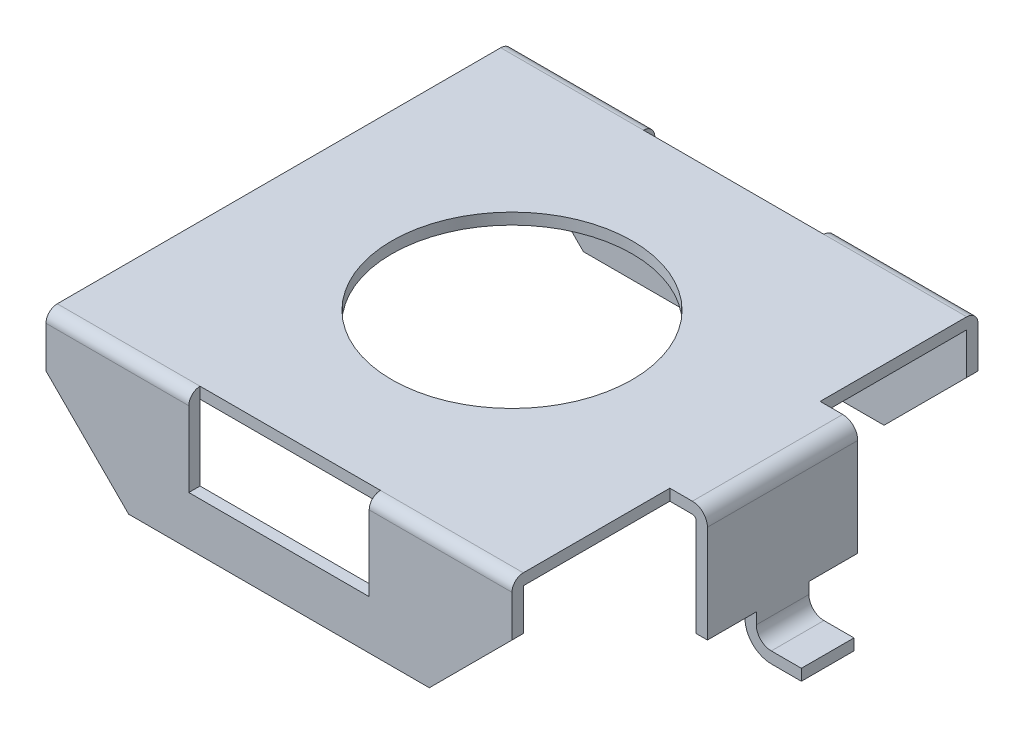
from build123d import *

# Parameters (mm, degrees)
EXTRUDE_THIN1_DEPTH     = 3.1
CUT_EXTRUDE1_DEPTH      = 5.818713521
CUT_EXTRUDE1_DEPTH_BACK = 5.818713521
SKETCH3_W               = 2.4
SKETCH3_H               = 1
SKETCH4_R               = 1.6
SKETCH4_W               = 2.4
SKETCH4_H               = 0.15
CUT_EXTRUDE2_DEPTH      = 0.15
FILLET1_R               = 0.15
EXTRUDE_THIN2_DEPTH     = 1
SKETCH6_W               = 1
SKETCH6_H               = 1
CUT_EXTRUDE3_DEPTH      = 0.5


with BuildPart() as part:
    # Sketch1 → Extrude-Thin1 (new, symmetric)
    with BuildSketch(Plane(origin=(0, 0, 0), x_dir=(0, 0, -1), z_dir=(1, 0, 0))):
        Polygon((-3.1, 0.2), (-3.1, 2), (3.1, 2), (3.1, 0.2), (2.95, 0.2), (2.95, 1.85), (-2.95, 1.85), (-2.95, 0.2), align=None)
    extrude(amount=EXTRUDE_THIN1_DEPTH, both=True)

    # Sketch3 → Cut-Extrude1 (cut, two sides: drawn at the far end of the back side and taken through both)
    with BuildSketch(Plane.XY.offset(-CUT_EXTRUDE1_DEPTH_BACK)):
        Polygon((-3.1, 1.3), (-3.1, 0.2), (-2, 0.2), align=None)
        Polygon((2, 0.2), (3.1, 0.2), (3.1, 1.3), align=None)
        with Locations((0, 1.35)):
            Rectangle(SKETCH3_W, SKETCH3_H)
    extrude(amount=CUT_EXTRUDE1_DEPTH + CUT_EXTRUDE1_DEPTH_BACK, mode=Mode.SUBTRACT)

    # Sketch4 → Cut-Extrude2 (cut)
    with BuildSketch(Plane(origin=(0, 2, 0), x_dir=(1, 0, 0), z_dir=(0, 1, 0))):
        with Locations(Location((0, 0, 0), (0, 0, 270))):
            Circle(SKETCH4_R)
        with Locations((0, 3.025)):
            Rectangle(SKETCH4_W, SKETCH4_H)
        with Locations((0, -3.025)):
            Rectangle(SKETCH4_W, SKETCH4_H)
    extrude(amount=-CUT_EXTRUDE2_DEPTH, mode=Mode.SUBTRACT)

    # Fillet1
    fillet1_edges = [part.edges().sort_by_distance(p)[0] for p in [
        (2.15, 2, 3.1),
        (-2.15, 2, 3.1),
        (2.15, 2, -3.1),
        (-2.15, 2, -3.1),
    ]]
    fillet(fillet1_edges, radius=FILLET1_R)

    # Sketch5 → Extrude-Thin2 (add, symmetric)
    with BuildSketch(Plane.XY):
        with BuildLine():
            Line((4.2, 0.15), (3.8, 0.15))
            ThreePointArc((3.8, 0.15), (3.658578644, 0.208578644), (3.6, 0.35))
            Line((3.6, 0.35), (3.6, 1.8))
            ThreePointArc((3.6, 1.8), (3.541421356, 1.941421356), (3.4, 2))
            Line((3.4, 2), (3.1, 2))
            Line((3.1, 2), (3.1, 1.85))
            Line((3.1, 1.85), (3.4, 1.85))
            ThreePointArc((3.4, 1.85), (3.435355339, 1.835355339), (3.45, 1.8))
            Line((3.45, 1.8), (3.45, 0.35))
            ThreePointArc((3.45, 0.35), (3.552512627, 0.102512627), (3.8, 0))
            Line((3.8, 0), (4.2, 0))
            Line((4.2, 0), (4.2, 0.15))
        make_face()
    extrude(amount=EXTRUDE_THIN2_DEPTH, both=True)

    # Sketch6 → Cut-Extrude3 (cut)
    with BuildSketch(Plane.XZ):
        with Locations((3.7, 0.85)):
            Rectangle(SKETCH6_W, SKETCH6_H)
        with Locations((3.7, -0.85)):
            Rectangle(SKETCH6_W, SKETCH6_H)
    extrude(amount=-CUT_EXTRUDE3_DEPTH, mode=Mode.SUBTRACT)


solid = part.part
